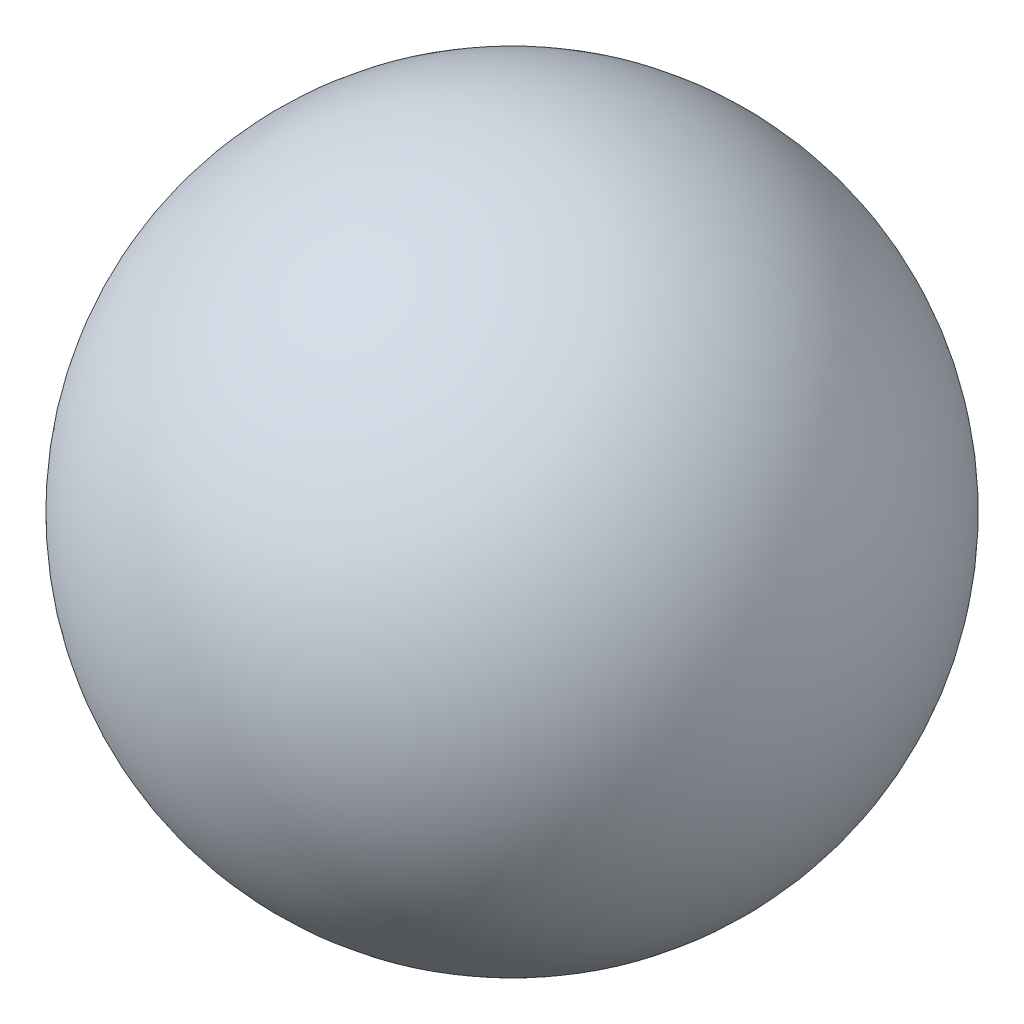
from build123d import *


with BuildPart() as part:
    # Sketch1 → Revolve1 (revolve)
    with BuildSketch(Plane.XY):
        with BuildLine():
            Line((0, 4), (0, -4))
            ThreePointArc((0, -4), (-4, 0), (0, 4))
        make_face()
    revolve(axis=Axis((0, 4, 0), (0, -1, 0)))


solid = part.part
